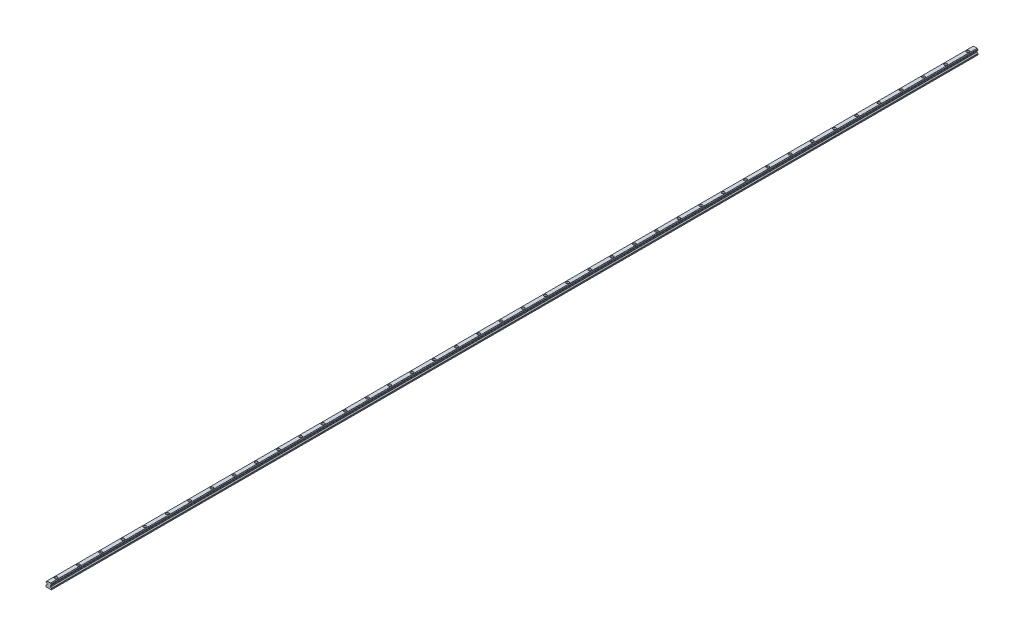
from build123d import *

# Parameters (mm, degrees)
BODY_DEPTH                                 = 2500
AESTHETIC_CHAMFER_SIZE                     = 0.15
PRODUCTION_FILLET_R                        = 0.1
MOUNTING_HOLES_PATTERN_COUNT               = 42
MOUNTING_HOLES_PATTERN_PITCH               = 60
PRODUCTION_FILLET_OF_MOUNTING_HOLES_PATT_R = 0.1


with BuildPart() as part:
    # Rail Profile → Body (new body)
    with BuildSketch(Plane.XY):
        with BuildLine():
            Line((-7, 0), (7, 0))
            Line((7, 0), (7.5, 0.5))
            Line((7.5, 0.5), (7.5, 3.085786438))
            ThreePointArc((7.5, 3.085786438), (7.423879533, 3.46846987), (7.207106781, 3.792893219))
            Line((7.207106781, 3.792893219), (4.867157288, 6.132842712))
            ThreePointArc((4.867157288, 6.132842712), (4.780448187, 6.262612052), (4.75, 6.415685425))
            Line((4.75, 6.415685425), (4.75, 8.584314575))
            ThreePointArc((4.75, 8.584314575), (4.780448187, 8.737387948), (4.867157288, 8.867157288))
            Line((4.867157288, 8.867157288), (5.062965362, 9.062965362))
            ThreePointArc((5.062965362, 9.062965362), (5.134996734, 9.161242682), (5.17409812, 9.27664646))
            ThreePointArc((5.17409812, 9.27664646), (5.61862915, 10.13137085), (6.47335354, 10.57590188))
            ThreePointArc((6.47335354, 10.57590188), (6.694124352, 10.694306692), (6.801170165, 10.920803148))
            ThreePointArc((6.801170165, 10.920803148), (6.915305692, 11.154571658), (7.149074202, 11.268707185))
            ThreePointArc((7.149074202, 11.268707185), (7.399691242, 11.400760606), (7.5, 11.665685425))
            Line((7.5, 11.665685425), (7.5, 12.334314575))
            ThreePointArc((7.5, 12.334314575), (7.399691242, 12.599239394), (7.149074202, 12.731292815))
            ThreePointArc((7.149074202, 12.731292815), (6.915305692, 12.845428342), (6.801170165, 13.079196852))
            ThreePointArc((6.801170165, 13.079196852), (6.694124352, 13.305693308), (6.47335354, 13.42409812))
            ThreePointArc((6.47335354, 13.42409812), (5.61862915, 13.86862915), (5.17409812, 14.72335354))
            ThreePointArc((5.17409812, 14.72335354), (5.134996734, 14.838757318), (5.062965362, 14.937034638))
            Line((5.062965362, 14.937034638), (5, 15))
            Line((5, 15), (-5, 15))
            Line((-5, 15), (-5.062965362, 14.937034638))
            ThreePointArc((-5.062965362, 14.937034638), (-5.134996734, 14.838757318), (-5.17409812, 14.72335354))
            ThreePointArc((-5.17409812, 14.72335354), (-5.61862915, 13.86862915), (-6.47335354, 13.42409812))
            ThreePointArc((-6.47335354, 13.42409812), (-6.694124352, 13.305693308), (-6.801170165, 13.079196852))
            ThreePointArc((-6.801170165, 13.079196852), (-6.915305692, 12.845428342), (-7.149074202, 12.731292815))
            ThreePointArc((-7.149074202, 12.731292815), (-7.399691242, 12.599239394), (-7.5, 12.334314575))
            Line((-7.5, 12.334314575), (-7.5, 11.665685425))
            ThreePointArc((-7.5, 11.665685425), (-7.399691242, 11.400760606), (-7.149074202, 11.268707185))
            ThreePointArc((-7.149074202, 11.268707185), (-6.915305692, 11.154571658), (-6.801170165, 10.920803148))
            ThreePointArc((-6.801170165, 10.920803148), (-6.694124352, 10.694306692), (-6.47335354, 10.57590188))
            ThreePointArc((-6.47335354, 10.57590188), (-5.61862915, 10.13137085), (-5.17409812, 9.27664646))
            ThreePointArc((-5.17409812, 9.27664646), (-5.134996734, 9.161242682), (-5.062965362, 9.062965362))
            Line((-5.062965362, 9.062965362), (-4.867157288, 8.867157288))
            ThreePointArc((-4.867157288, 8.867157288), (-4.780448187, 8.737387948), (-4.75, 8.584314575))
            Line((-4.75, 8.584314575), (-4.75, 6.415685425))
            ThreePointArc((-4.75, 6.415685425), (-4.780448187, 6.262612052), (-4.867157288, 6.132842712))
            Line((-4.867157288, 6.132842712), (-7.207106781, 3.792893219))
            ThreePointArc((-7.207106781, 3.792893219), (-7.423879533, 3.46846987), (-7.5, 3.085786438))
            Line((-7.5, 3.085786438), (-7.5, 0.5))
            Line((-7.5, 0.5), (-7, 0))
        make_face()
    extrude(amount=-BODY_DEPTH)

    # Aesthetic Chamfer
    aesthetic_chamfer_edges = [part.edges().sort_by_distance(p)[0] for p in [
        (7.423879533, 3.46846987, -2500),
        (-5.134996734, 9.161242682, -2500),
        (-4.965061325, 8.965061325, -2500),
        (-4.780448187, 8.737387948, -2500),
        (-4.75, 7.5, -2500),
        (-4.780448187, 6.262612052, -2500),
        (-6.037132034, 4.962867966, -2500),
        (-7.423879533, 3.46846987, -2500),
        (-7.5, 1.792893219, -2500),
        (-7.25, 0.25, -2500),
        (0, 0, -2500),
        (6.037132034, 4.962867966, -2500),
        (4.780448187, 6.262612052, -2500),
        (4.75, 7.5, -2500),
        (4.780448187, 8.737387948, -2500),
        (4.965061325, 8.965061325, -2500),
        (5.134996734, 9.161242682, -2500),
        (5.61862915, 10.13137085, -2500),
        (6.694124352, 10.694306692, -2500),
        (0, 0, 0),
        (-7.25, 0.25, 0),
        (-7.5, 1.792893219, 0),
        (-7.423879533, 3.46846987, 0),
        (-6.037132034, 4.962867966, 0),
        (-4.780448187, 6.262612052, 0),
        (6.915305692, 11.154571658, -2500),
        (-4.75, 7.5, 0),
        (-4.780448187, 8.737387948, 0),
        (-4.965061325, 8.965061325, 0),
        (-5.134996734, 9.161242682, 0),
        (-5.61862915, 10.13137085, 0),
        (-6.694124352, 10.694306692, 0),
        (-6.915305692, 11.154571658, 0),
        (7.25, 0.25, -2500),
        (7.399691242, 11.400760606, -2500),
        (-7.399691242, 11.400760606, 0),
        (-7.5, 12, 0),
        (-7.399691242, 12.599239394, 0),
        (-6.915305692, 12.845428342, 0),
        (-6.694124352, 13.305693308, 0),
        (-5.61862915, 13.86862915, 0),
        (-5.134996734, 14.838757318, 0),
        (-5.031482681, 14.968517319, 0),
        (7.5, 12, -2500),
        (0, 15, 0),
        (5.031482681, 14.968517319, 0),
        (5.134996734, 14.838757318, 0),
        (5.61862915, 13.86862915, 0),
        (6.694124352, 13.305693308, 0),
        (6.915305692, 12.845428342, 0),
        (7.399691242, 12.599239394, 0),
        (7.399691242, 12.599239394, -2500),
        (7.5, 12, 0),
        (7.399691242, 11.400760606, 0),
        (6.915305692, 11.154571658, 0),
        (6.694124352, 10.694306692, 0),
        (5.61862915, 10.13137085, 0),
        (5.134996734, 9.161242682, 0),
        (4.965061325, 8.965061325, 0),
        (4.780448187, 8.737387948, 0),
        (6.915305692, 12.845428342, -2500),
        (4.75, 7.5, 0),
        (4.780448187, 6.262612052, 0),
        (6.037132034, 4.962867966, 0),
        (7.423879533, 3.46846987, 0),
        (7.5, 1.792893219, 0),
        (7.25, 0.25, 0),
        (6.694124352, 13.305693308, -2500),
        (5.61862915, 13.86862915, -2500),
        (5.134996734, 14.838757318, -2500),
        (5.031482681, 14.968517319, -2500),
        (0, 15, -2500),
        (-5.031482681, 14.968517319, -2500),
        (7.5, 1.792893219, -2500),
        (-5.134996734, 14.838757318, -2500),
        (-5.61862915, 13.86862915, -2500),
        (-6.694124352, 13.305693308, -2500),
        (-6.915305692, 12.845428342, -2500),
        (-7.399691242, 12.599239394, -2500),
        (-7.5, 12, -2500),
        (-7.399691242, 11.400760606, -2500),
        (-6.915305692, 11.154571658, -2500),
        (-6.694124352, 10.694306692, -2500),
        (-5.61862915, 10.13137085, -2500),
    ]]
    chamfer(aesthetic_chamfer_edges, length=AESTHETIC_CHAMFER_SIZE)

    # Sketch1 → Mounting Hole (revolve, cut)
    with BuildSketch(Plane(origin=(0, 15, -20), x_dir=(0, 0, 1), z_dir=(1, 0, 0))):
        Polygon((0, 0), (0, 15), (2.35, 15), (2.25, 14.9), (2.25, 5.4), (2.35, 5.3), (3.75, 5.3), (3.75, 0.1), (3.85, 0), align=None)
    mounting_hole = revolve(axis=Axis((0, 21.35, -20), (0, -1, 0)), mode=Mode.SUBTRACT)

    # Production Fillet
    production_fillet_edges = [part.edges().sort_by_distance(p)[0] for p in [
        (0, 9.7, -23.75),
    ]]
    fillet(production_fillet_edges, radius=PRODUCTION_FILLET_R)

    # Mounting Holes Pattern: Mounting Hole ×42
    with Locations(*[(0, 0, -i * MOUNTING_HOLES_PATTERN_PITCH) for i in range(1, MOUNTING_HOLES_PATTERN_COUNT)]):
        add(mounting_hole, mode=Mode.SUBTRACT)

    # Production Fillet of Mounting Holes Patt
    production_fillet_of_mounting_holes_patt_edges = [part.edges().sort_by_distance(p)[0] for p in [
        (0, 9.7, -83.75),
        (0, 9.7, -143.75),
        (0, 9.7, -203.75),
        (0, 9.7, -263.75),
        (0, 9.7, -323.75),
        (0, 9.7, -383.75),
        (0, 9.7, -443.75),
        (0, 9.7, -503.75),
        (0, 9.7, -563.75),
        (0, 9.7, -623.75),
        (0, 9.7, -683.75),
        (0, 9.7, -743.75),
        (0, 9.7, -803.75),
        (0, 9.7, -863.75),
        (0, 9.7, -923.75),
        (0, 9.7, -983.75),
        (0, 9.7, -1043.75),
        (0, 9.7, -1103.75),
        (0, 9.7, -1163.75),
        (0, 9.7, -1223.75),
        (0, 9.7, -1283.75),
        (0, 9.7, -1343.75),
        (0, 9.7, -1403.75),
        (0, 9.7, -1463.75),
        (0, 9.7, -1523.75),
        (0, 9.7, -1583.75),
        (0, 9.7, -1643.75),
        (0, 9.7, -1703.75),
        (0, 9.7, -1763.75),
        (0, 9.7, -1823.75),
        (0, 9.7, -1883.75),
        (0, 9.7, -1943.75),
        (0, 9.7, -2003.75),
        (0, 9.7, -2063.75),
        (0, 9.7, -2123.75),
        (0, 9.7, -2183.75),
        (0, 9.7, -2243.75),
        (0, 9.7, -2303.75),
        (0, 9.7, -2363.75),
        (0, 9.7, -2423.75),
        (0, 9.7, -2483.75),
    ]]
    fillet(production_fillet_of_mounting_holes_patt_edges, radius=PRODUCTION_FILLET_OF_MOUNTING_HOLES_PATT_R)


solid = part.part
